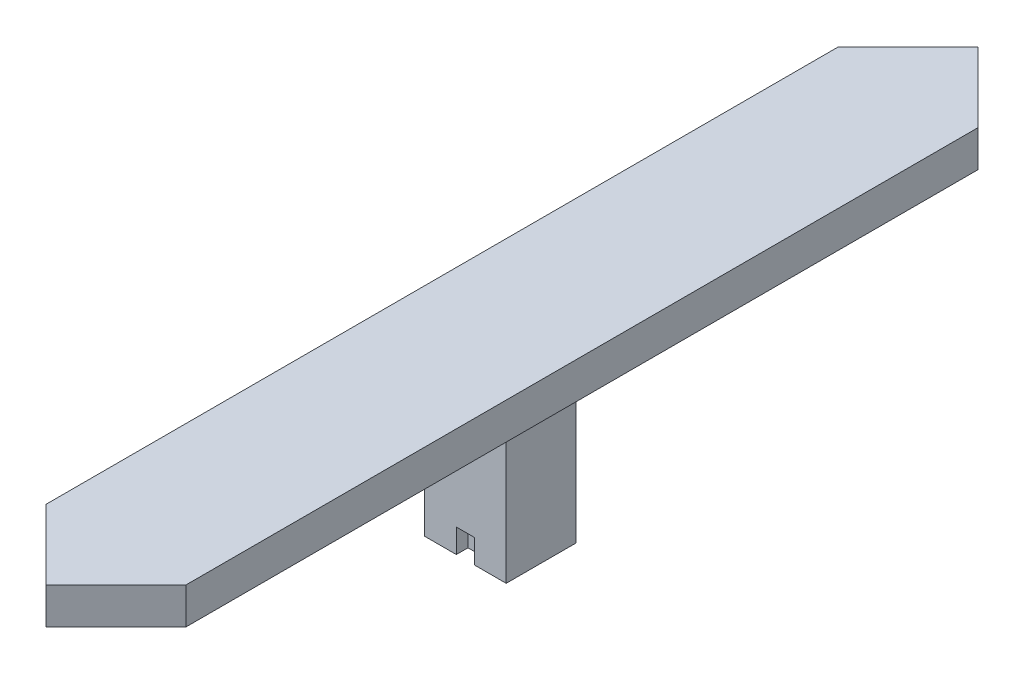
from build123d import *

# Parameters (mm, degrees)
BOSS_EXTRUDE1_DEPTH = 3.125
SKETCH2_W           = 7
SKETCH2_H           = 4
BOSS_EXTRUDE2_DEPTH = 13
CUT_EXTRUDE1_DEPTH  = 2.5
SKETCH4_W           = 7
SKETCH4_H           = 13
BOSS_EXTRUDE3_DEPTH = 2
SKETCH5_W           = 1.55719089
SKETCH5_H           = 4.099138032
CUT_EXTRUDE2_DEPTH  = 1


with BuildPart() as part:
    # Sketch1 → Boss-Extrude1 (new body)
    with BuildSketch(Plane(origin=(0, 0, 0), x_dir=(1, 0, 0), z_dir=(0, 1, 0))):
        Polygon((0, 0), (6, -6), (6, -74), (0, -80), (-6, -74), (-6, -6), align=None)
    extrude(amount=BOSS_EXTRUDE1_DEPTH)

    # Sketch2 → Boss-Extrude2 (add)
    with BuildSketch(Plane.XZ):
        with Locations((0, 40)):
            Rectangle(SKETCH2_W, SKETCH2_H)
    extrude(amount=BOSS_EXTRUDE2_DEPTH)

    # Sketch3 → Cut-Extrude1 (cut)
    with BuildSketch(Plane.XY.offset(42)):
        with BuildLine():
            Line((3.5, -14.64), (-3.5, -14.64))
            Line((-3.5, -14.64), (-2.25, -2.8))
            ThreePointArc((-2.25, -2.8), (0, -0.55), (2.25, -2.8))
            Line((2.25, -2.8), (3.5, -14.64))
        make_face()
    extrude(amount=-CUT_EXTRUDE1_DEPTH, mode=Mode.SUBTRACT)

    # Sketch4 → Boss-Extrude3 (add)
    with BuildSketch(Plane.XY.offset(42)):
        with Locations((0, -6.5)):
            Rectangle(SKETCH4_W, SKETCH4_H)
    extrude(amount=BOSS_EXTRUDE3_DEPTH)

    # Sketch5 → Cut-Extrude2 (cut)
    with BuildSketch(Plane.XY.offset(44)):
        with Locations((0, -13)):
            Rectangle(SKETCH5_W, SKETCH5_H)
    extrude(amount=-CUT_EXTRUDE2_DEPTH, mode=Mode.SUBTRACT)


solid = part.part
